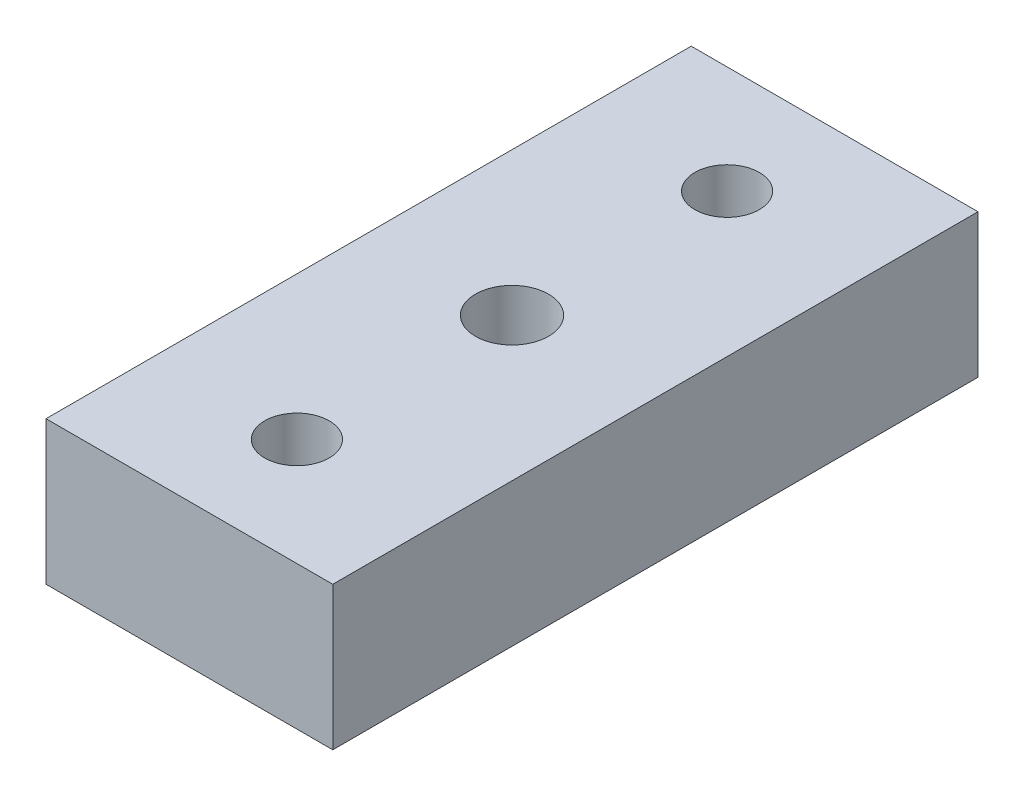
from build123d import *

# Parameters (mm, degrees)
SKETCH1_W               = 40
SKETCH1_H               = 90
BOSS_EXTRUDE1_DEPTH     = 20
CUT_EXTRUDE1_DEPTH      = 54.150729064
CUT_EXTRUDE1_DEPTH_BACK = 54.150729064
SKETCH2_R               = 5.1
CUT_EXTRUDE2_DEPTH      = 54.150729064
CUT_EXTRUDE2_DEPTH_BACK = 54.150729064
SKETCH3_R               = 4.5
SKETCH4_R               = 7
CUT_EXTRUDE4_DEPTH      = 9


with BuildPart() as part:
    # Sketch1 → Boss-Extrude1 (new body)
    with BuildSketch(Plane(origin=(0, 0, 0), x_dir=(1, 0, 0), z_dir=(0, 1, 0))):
        Rectangle(SKETCH1_W, SKETCH1_H)
    extrude(amount=BOSS_EXTRUDE1_DEPTH)

    # Sketch2 → Cut-Extrude1 (cut, two sides: drawn at the far end of the back side and taken through both)
    with BuildSketch(Plane(origin=(0, 0, 0), x_dir=(1, 0, 0), z_dir=(0, 1, 0)).offset(-CUT_EXTRUDE1_DEPTH_BACK)):
        with Locations(Location((0, 0, 0), (0, 0, 270))):
            Circle(SKETCH2_R)
    extrude(amount=CUT_EXTRUDE1_DEPTH + CUT_EXTRUDE1_DEPTH_BACK, mode=Mode.SUBTRACT)

    # Sketch3 → Cut-Extrude2 (cut, two sides: drawn at the far end of the back side and taken through both)
    with BuildSketch(Plane(origin=(0, 0, 0), x_dir=(1, 0, 0), z_dir=(0, 1, 0)).offset(-CUT_EXTRUDE2_DEPTH_BACK)):
        with Locations(Location((0, -30, 0), (0, 0, 270))):
            Circle(SKETCH3_R)
        with Locations(Location((0, 30, 0), (0, 0, 270))):
            Circle(SKETCH3_R)
    extrude(amount=CUT_EXTRUDE2_DEPTH + CUT_EXTRUDE2_DEPTH_BACK, mode=Mode.SUBTRACT)

    # Sketch4 → Cut-Extrude4 (cut)
    with BuildSketch(Plane(origin=(0, 0, 0), x_dir=(1, 0, 0), z_dir=(0, 1, 0))):
        with Locations(Location((0, -30, 0), (0, 0, 270))):
            Circle(SKETCH4_R)
        with Locations(Location((0, 30, 0), (0, 0, 270))):
            Circle(SKETCH4_R)
    extrude(amount=CUT_EXTRUDE4_DEPTH, mode=Mode.SUBTRACT)


solid = part.part
